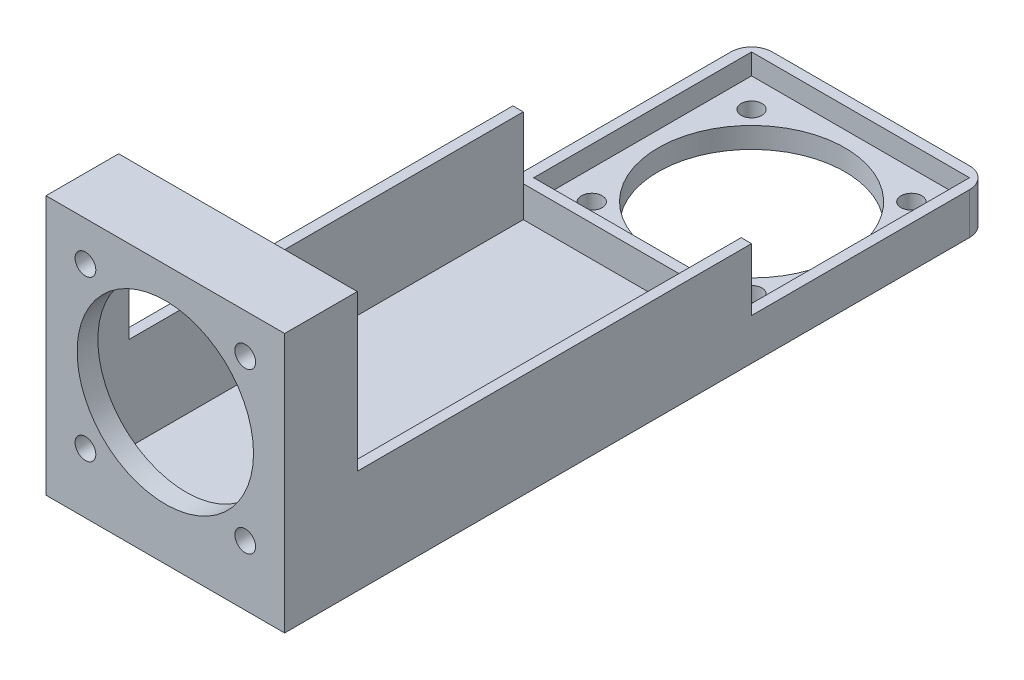
from build123d import *

# Parameters (mm, degrees)
SKETCH_1_W           = 23
SKETCH_1_H           = 23
SKETCH_1_W_2         = 21
SKETCH_1_H_2         = 21
EXTRUDE_1_DEPTH      = 4
SKETCH_2_W           = 21
SKETCH_2_H           = 21
EXTRUDE_2_DEPTH      = 2
CUT_EXTRUDE_1_DEPTH  = 2
FILLET_2_R           = 2
FILLET_3_R           = 2
EXTRUDE_6_DEPTH      = 45
SKETCH_19_W          = 23
SKETCH_19_H          = 2
EXTRUDE_7_DEPTH      = 24
SKETCH_4_R           = 1
CUT_EXTRUDE_9_DEPTH  = 20
EXTRUDE_8_DEPTH      = 5
SKETCH_22_R          = 8.5
SKETCH_22_R_2        = 1
CUT_EXTRUDE_11_DEPTH = 5


with BuildPart() as part:
    # 草图1 → 凸台-拉伸1 (new body)
    with BuildSketch(Plane(origin=(0, 0, 0), x_dir=(1, 0, 0), z_dir=(0, 1, 0))):
        with Locations((10.5, 10.5)):
            Rectangle(SKETCH_1_W, SKETCH_1_H)
        with Locations((10.5, 10.5)):
            Rectangle(SKETCH_1_W_2, SKETCH_1_H_2, mode=Mode.SUBTRACT)
    extrude(amount=EXTRUDE_1_DEPTH)

    # 草图2 → 凸台-拉伸2 (add)
    with BuildSketch(Plane(origin=(0, 0, 0), x_dir=(1, 0, 0), z_dir=(0, 1, 0))):
        with Locations((10.5, 10.5)):
            Rectangle(SKETCH_2_W, SKETCH_2_H)
    extrude(amount=EXTRUDE_2_DEPTH)

    # 草图3 → 切除-拉伸1 (cut)
    with BuildSketch(Plane(origin=(0, 2, 0), x_dir=(1, 0, 0), z_dir=(0, 1, 0))):
        with BuildLine():
            ThreePointArc((19.5, 10.5), (10.5, 19.5), (1.5, 10.5))
            Line((1.5, 10.5), (19.5, 10.5))
        make_face()
        with BuildLine():
            Line((19.5, 10.5), (1.5, 10.5))
            ThreePointArc((1.5, 10.5), (10.5, 1.5), (19.5, 10.5))
        make_face()
    extrude(amount=-CUT_EXTRUDE_1_DEPTH, mode=Mode.SUBTRACT)

    # 圆角2
    fillet_2_edges = [part.edges().sort_by_distance(p)[0] for p in [
        (-1, 2, -22),
    ]]
    fillet(fillet_2_edges, radius=FILLET_2_R)

    # 圆角3
    fillet_3_edges = [part.edges().sort_by_distance(p)[0] for p in [
        (22, 2, -22),
    ]]
    fillet(fillet_3_edges, radius=FILLET_3_R)

    # 草图18 → 凸台-拉伸6 (add)
    with BuildSketch(Plane.XY.offset(1)):
        Polygon((-1, 0), (22, 0), (22, 10), (21, 10), (21, 1), (0, 1), (0, 10), (-1, 10), align=None)
    extrude(amount=EXTRUDE_6_DEPTH)

    # 草图19 → 凸台-拉伸7 (add)
    with BuildSketch(Plane(origin=(0, 1, 0), x_dir=(1, 0, 0), z_dir=(0, 1, 0))):
        with Locations((10.5, -45)):
            Rectangle(SKETCH_19_W, SKETCH_19_H)
    extrude(amount=EXTRUDE_7_DEPTH)

    # 草图4 → 切除-拉伸9 (cut)
    with BuildSketch(Plane(origin=(0, 2, 0), x_dir=(1, 0, 0), z_dir=(0, 1, 0))):
        with Locations(Location((2.8, 18.2, 0), (0, 0, 270))):
            Circle(SKETCH_4_R)
        with Locations(Location((2.8, 2.8, 0), (0, 0, 270))):
            Circle(SKETCH_4_R)
        with Locations(Location((18.2, 2.8, 0), (0, 0, 270))):
            Circle(SKETCH_4_R)
        with Locations(Location((18.2, 18.2, 0), (0, 0, 270))):
            Circle(SKETCH_4_R)
    extrude(amount=-CUT_EXTRUDE_9_DEPTH, mode=Mode.SUBTRACT)

    # 草图24 → 凸台-拉伸8 (add)
    with BuildSketch(Plane(origin=(0, 0, 44), x_dir=(-1, 0, 0), z_dir=(0, 0, -1))):
        Polygon((-22, 10), (-22, 25), (1, 25), (1, 10), (0, 10), (0, 24), (-21, 24), (-21, 10), align=None)
    extrude(amount=EXTRUDE_8_DEPTH)

    # 草图22 → 切除-拉伸11 (cut)
    with BuildSketch(Plane.XY.offset(46)):
        with Locations((10.5, 13.5)):
            Circle(SKETCH_22_R)
        with Locations((18.2, 21.2)):
            Circle(SKETCH_22_R_2)
        with Locations((2.8, 21.2)):
            Circle(SKETCH_22_R_2)
        with Locations((2.8, 5.8)):
            Circle(SKETCH_22_R_2)
        with Locations((18.2, 5.8)):
            Circle(SKETCH_22_R_2)
    extrude(amount=-CUT_EXTRUDE_11_DEPTH, mode=Mode.SUBTRACT)


solid = part.part
